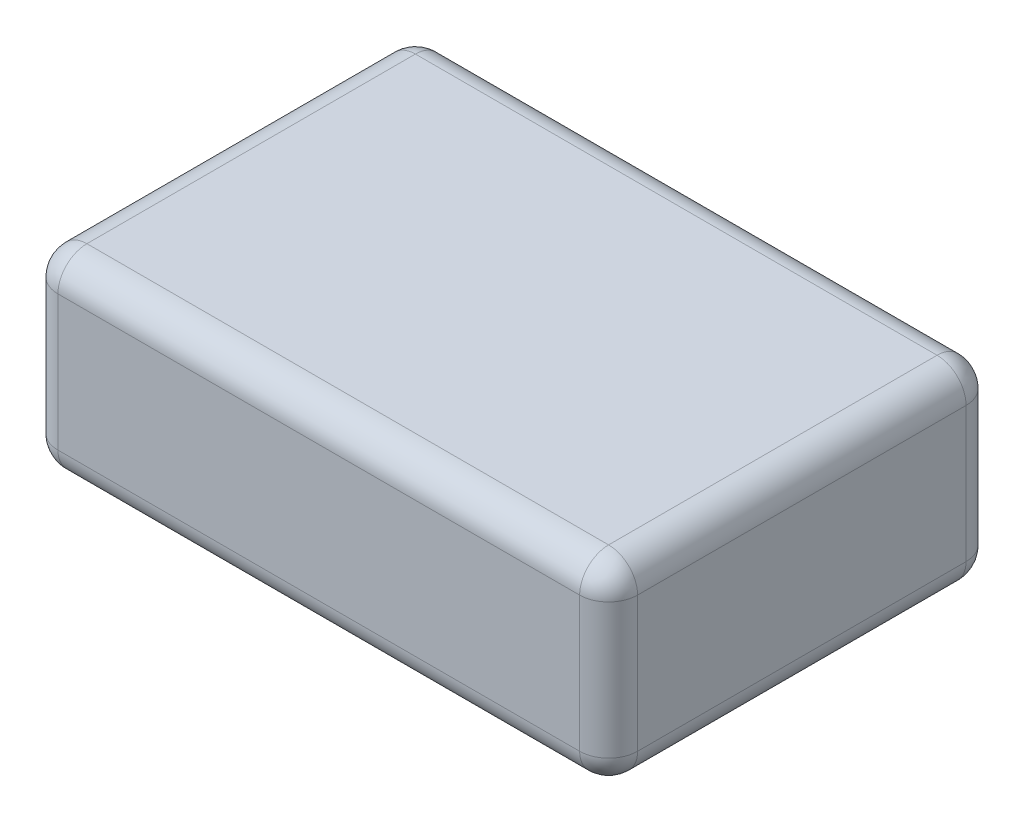
from build123d import *

# Parameters (mm, degrees)
SKETCH2_W           = 300
SKETCH2_H           = 100
BOSS_EXTRUDE1_DEPTH = 100
FILLET1_R           = 15


with BuildPart() as part:
    # Sketch2 → Boss-Extrude1 (new, symmetric)
    with BuildSketch(Plane.XY):
        Rectangle(SKETCH2_W, SKETCH2_H)
    extrude(amount=BOSS_EXTRUDE1_DEPTH, both=True)

    # Fillet1
    fillet1_edges = [part.edges().sort_by_distance(p)[0] for p in [
        (150, 0, 100),
        (0, -50, 100),
        (-150, 0, 100),
        (0, -50, -100),
        (150, 0, -100),
        (0, 50, -100),
        (-150, 0, -100),
        (-150, -50, 0),
        (150, -50, 0),
        (150, 50, 0),
        (-150, 50, 0),
        (0, 50, 100),
    ]]
    fillet(fillet1_edges, radius=FILLET1_R)


solid = part.part
